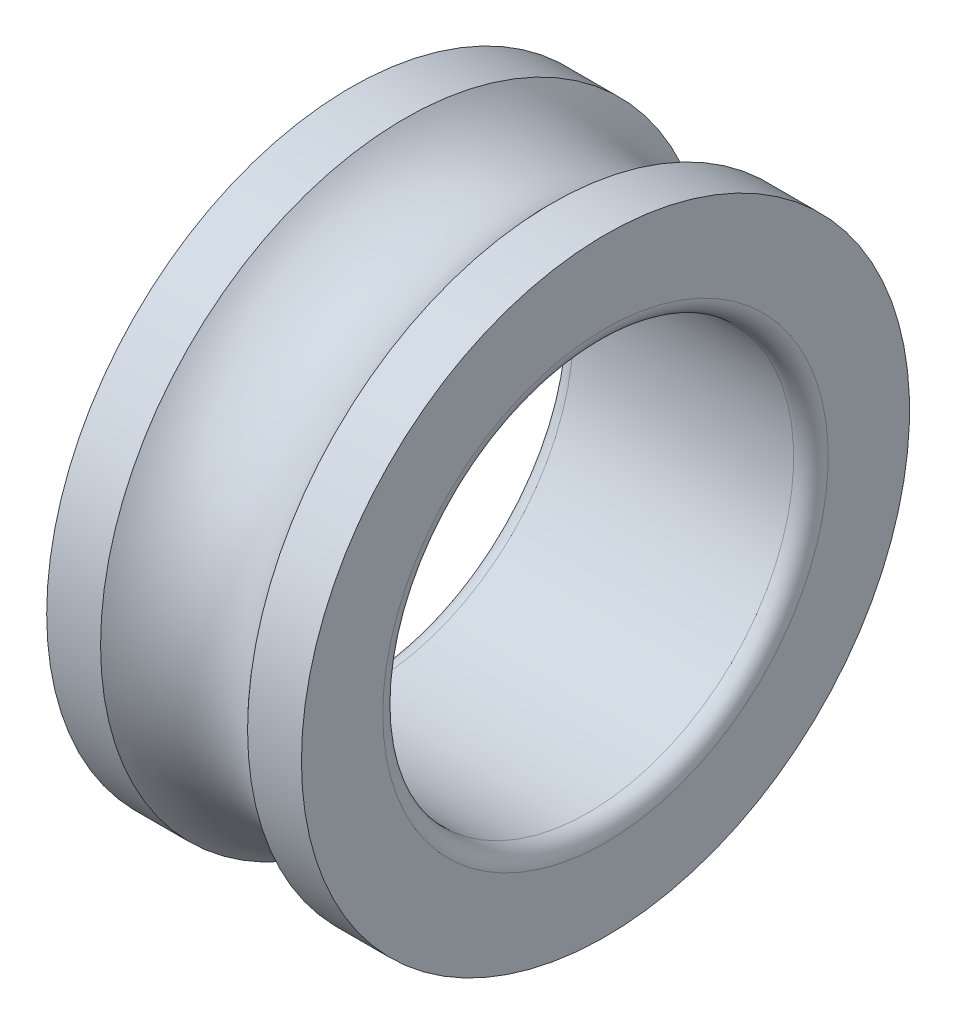
from build123d import *


with BuildPart() as part:
    # Çizim1 → Döndür1 (revolve)
    with BuildSketch(Plane.XY, mode=Mode.PRIVATE) as d_nd_r1_sk:
        with BuildLine():
            Line((-15.5, 37), (-8.94427191, 37))
            ThreePointArc((-8.94427191, 37), (0, 33), (8.94427191, 37))
            Line((8.94427191, 37), (15.5, 37))
            Line((15.5, 37), (15.5, 27.1))
            ThreePointArc((15.5, 27.1), (14.88492424, 25.61507576), (13.4, 25))
            Line((13.4, 25), (-13.4, 25))
            ThreePointArc((-13.4, 25), (-14.88492424, 25.61507576), (-15.5, 27.1))
            Line((-15.5, 27.1), (-15.5, 37))
        make_face()
    revolve(d_nd_r1_sk.sketch.rotate(Axis((-12.336734694, 0, 0), (1, 0, 0)), 90), axis=Axis((-12.336734694, 0, 0), (1, 0, 0)))


solid = part.part
